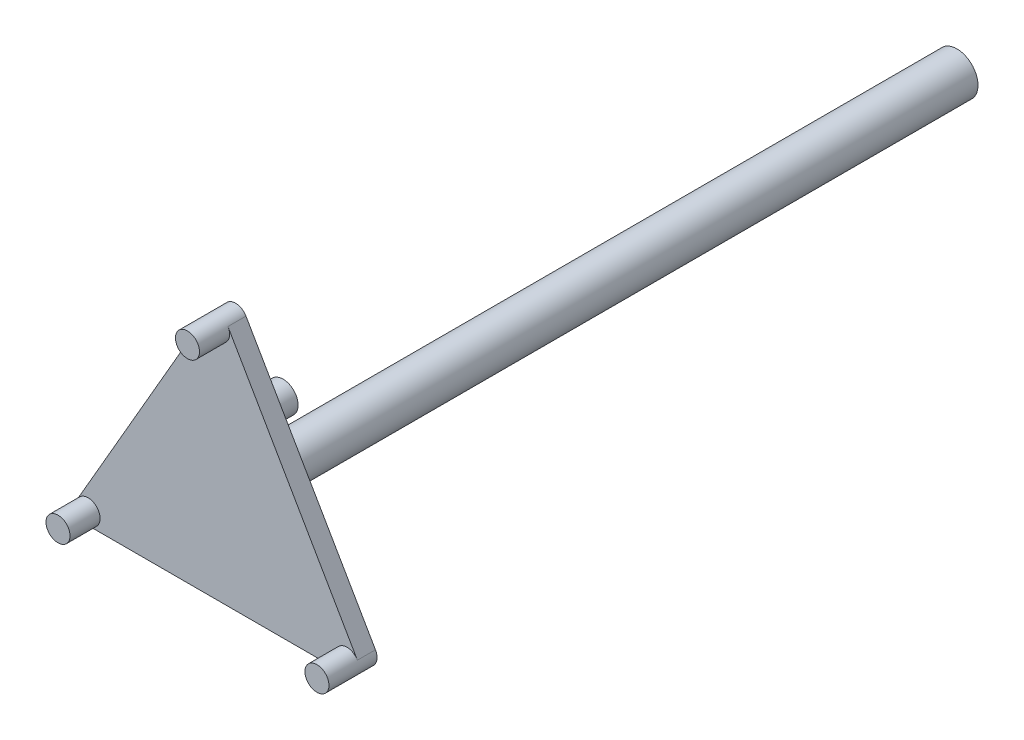
from build123d import *

# Parameters (mm, degrees)
BOSS_EXTRUDE1_DEPTH = 3
SKETCH2_R           = 3.5
BOSS_EXTRUDE2_DEPTH = 10
SKETCH3_R           = 2
BOSS_EXTRUDE3_DEPTH = 5
SKETCH4_R           = 2.5
BOSS_EXTRUDE4_DEPTH = 3
CIRPATTERN1_COUNT   = 3
SKETCH5_R           = 3.5
BOSS_EXTRUDE6_DEPTH = 110


with BuildPart() as part:
    # Sketch1 → Boss-Extrude1 (new body)
    with BuildSketch(Plane.XY):
        with BuildLine():
            Line((23.267949192, -11.43375673), (1.732050808, 25.867513459))
            ThreePointArc((1.732050808, 25.867513459), (0, 26.867513459), (-1.732050808, 25.867513459))
            Line((-1.732050808, 25.867513459), (-23.267949192, -11.43375673))
            ThreePointArc((-23.267949192, -11.43375673), (-23.267949192, -13.43375673), (-21.535898385, -14.43375673))
            Line((-21.535898385, -14.43375673), (21.535898385, -14.43375673))
            ThreePointArc((21.535898385, -14.43375673), (23.267949192, -13.43375673), (23.267949192, -11.43375673))
        make_face()
    extrude(amount=BOSS_EXTRUDE1_DEPTH)

    # Sketch2 → Boss-Extrude2 (add)
    with BuildSketch(Plane(origin=(0, 0, 0), x_dir=(-1, 0, 0), z_dir=(0, 0, -1))):
        with Locations(Location((0, 0, 0), (0, 0, 180))):
            Circle(SKETCH2_R)
    extrude(amount=BOSS_EXTRUDE2_DEPTH)

    # Sketch3 → Boss-Extrude3 (add)
    with BuildSketch(Plane.XY.offset(3)):
        with Locations(Location((0, 24.867513459, 0), (0, 0, 150))):
            Circle(SKETCH3_R)
        with Locations(Location((21.535898385, -12.43375673, 0), (0, 0, 270))):
            Circle(SKETCH3_R)
        with Locations(Location((-21.535898385, -12.43375673, 0), (0, 0, 150))):
            Circle(SKETCH3_R)
    extrude(amount=BOSS_EXTRUDE3_DEPTH)

    # Sketch4 → Boss-Extrude4 (add)
    with BuildSketch(Plane(origin=(0, 0, 0), x_dir=(-1, 0, 0), z_dir=(0, 0, -1))):
        with Locations(Location((-10, -11.43375673, 0), (0, 0, 180))):
            Circle(SKETCH4_R)
    boss_extrude4 = extrude(amount=BOSS_EXTRUDE4_DEPTH)

    # CirPattern1: Boss-Extrude4 ×3 about axis
    cirpattern1_axis = Axis((0, 0, 0), (0, 0, 1))
    for i in range(1, CIRPATTERN1_COUNT):
        add(boss_extrude4.rotate(cirpattern1_axis, i * 360 / CIRPATTERN1_COUNT))

    # Sketch5 → Boss-Extrude6 (add)
    with BuildSketch(Plane(origin=(0, 0, -10), x_dir=(-1, 0, 0), z_dir=(0, 0, -1))):
        with Locations(Location((0, 0, 0), (0, 0, 180))):
            Circle(SKETCH5_R)
    extrude(amount=BOSS_EXTRUDE6_DEPTH)


solid = part.part
